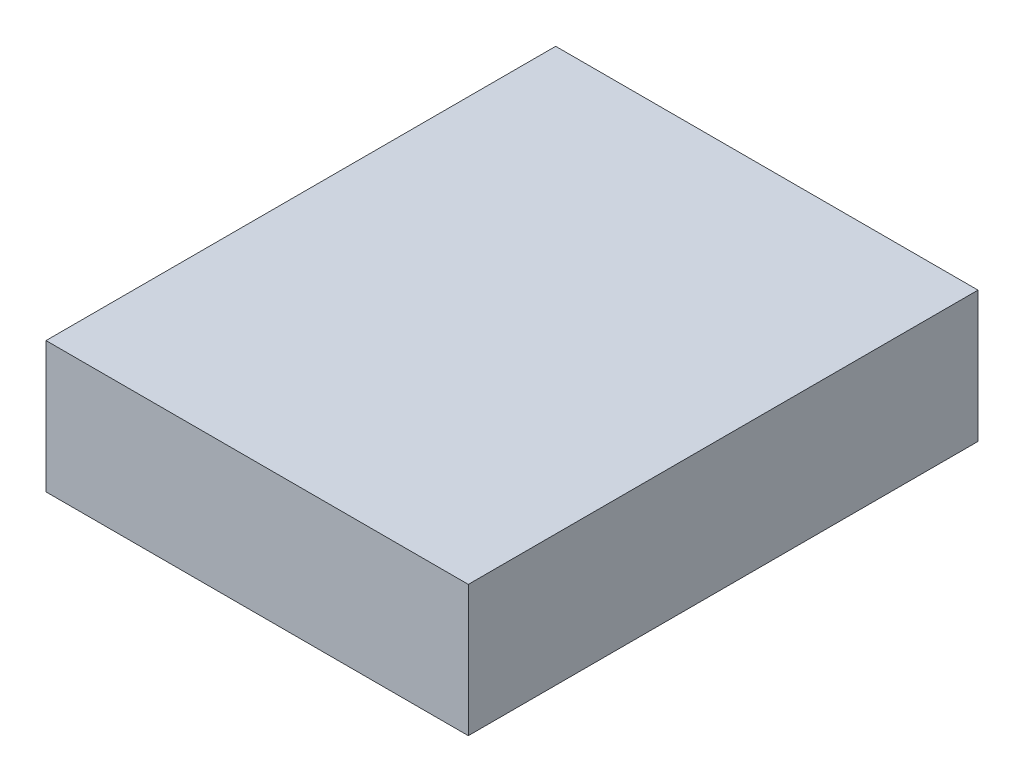
from build123d import *

# Parameters (mm, degrees)
SKETCH_1_W      = 58
SKETCH_1_H      = 70
EXTRUDE_1_DEPTH = 18


with BuildPart() as part:
    # Эскиз1 → Бобышка-Вытянуть1 (new body)
    with BuildSketch(Plane(origin=(0, 0, 0), x_dir=(1, 0, 0), z_dir=(0, 1, 0))):
        Rectangle(SKETCH_1_W, SKETCH_1_H)
    extrude(amount=EXTRUDE_1_DEPTH)


solid = part.part
